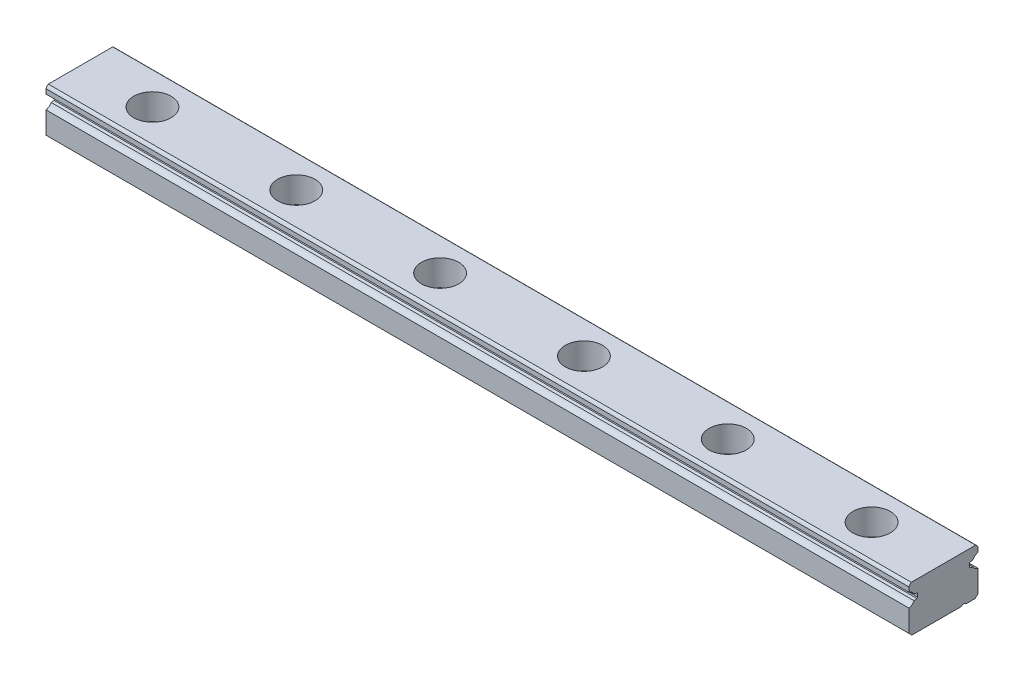
from build123d import *

# Parameters (mm, degrees)
EXTRUDE1_DEPTH  = 150
SKETCH8_R       = 0.5
EXTRUDE2_DEPTH  = 150
LPATTERN1_COUNT = 5
LPATTERN1_PITCH = 25


with BuildPart() as part:
    # Sketch1 → Extrude1 (new body)
    with BuildSketch(Plane(origin=(0, 0, 0), x_dir=(0, 0, -1), z_dir=(1, 0, 0))):
        with BuildLine():
            Line((-6, 0.5), (-5.5, 0))
            Line((-5.5, 0), (5.5, 0))
            Line((5.5, 0), (6, 0.5))
            Line((6, 0.5), (6, 4.316784043))
            ThreePointArc((6, 4.316784043), (5.473240049, 4.54510735), (5.1128312, 4.992))
            Line((5.1128312, 4.992), (4.622, 5.078546784))
            ThreePointArc((4.622, 5.078546784), (4.552906648, 5.14064182), (4.5, 5.217))
            Line((4.5, 5.217), (4.5, 5.783))
            ThreePointArc((4.5, 5.783), (4.552906648, 5.85935818), (4.622, 5.921453216))
            Line((4.622, 5.921453216), (5.1128312, 6.008))
            ThreePointArc((5.1128312, 6.008), (5.473240049, 6.45489265), (6, 6.683215957))
            Line((6, 6.683215957), (6, 7.5))
            ThreePointArc((6, 7.5), (5.841101212, 7.78288097), (5.6, 8))
            Line((5.6, 8), (-5.6, 8))
            ThreePointArc((-5.6, 8), (-5.841101212, 7.78288097), (-6, 7.5))
            Line((-6, 7.5), (-6, 6.683215957))
            ThreePointArc((-6, 6.683215957), (-5.473240049, 6.45489265), (-5.1128312, 6.008))
            Line((-5.1128312, 6.008), (-4.622, 5.921453216))
            ThreePointArc((-4.622, 5.921453216), (-4.552906648, 5.85935818), (-4.5, 5.783))
            Line((-4.5, 5.783), (-4.5, 5.217))
            ThreePointArc((-4.5, 5.217), (-4.552906648, 5.14064182), (-4.622, 5.078546784))
            Line((-4.622, 5.078546784), (-5.1128312, 4.992))
            ThreePointArc((-5.1128312, 4.992), (-5.473240049, 4.54510735), (-6, 4.316784043))
            Line((-6, 4.316784043), (-6, 0.5))
        make_face()
    extrude(amount=EXTRUDE1_DEPTH)

    # Sketch2 → Cut-Revolve1 (revolve, cut)
    with BuildSketch(Plane(origin=(0, 0, 0), x_dir=(-1, 0, 0), z_dir=(0, 0, -1))):
        Polygon((-12.5, 8), (-9.25, 8), (-9.25, 3.5), (-10.75, 3.5), (-10.75, 0.2), (-10.55, 0), (-12.5, 0), align=None)
    revolve(axis=Axis((12.5, 0, 0), (0, 1, 0)), mode=Mode.SUBTRACT)

    # Sketch3 → Cut-Revolve2 (revolve, cut)
    with BuildSketch(Plane(origin=(125, 0, 0), x_dir=(-1, 0, 0), z_dir=(0, 0, -1))):
        Polygon((-12.5, 8), (-9.25, 8), (-9.25, 3.5), (-10.75, 3.5), (-10.75, 0.2), (-10.55, 0), (-12.5, 0), align=None)
    cut_revolve2 = revolve(axis=Axis((137.5, 0, 0), (0, 1, 0)), mode=Mode.SUBTRACT)

    # Sketch8 → Extrude2 (cut)
    with BuildSketch(Plane(origin=(0, 0, 0), x_dir=(0, 0, -1), z_dir=(1, 0, 0))):
        with Locations((3.5, -0.3)):
            Circle(SKETCH8_R)
    extrude(amount=EXTRUDE2_DEPTH, mode=Mode.SUBTRACT)

    # LPattern1: Cut-Revolve2 ×5
    with Locations(*[(-i * LPATTERN1_PITCH, 0, 0) for i in range(1, LPATTERN1_COUNT)]):
        add(cut_revolve2, mode=Mode.SUBTRACT)


solid = part.part
